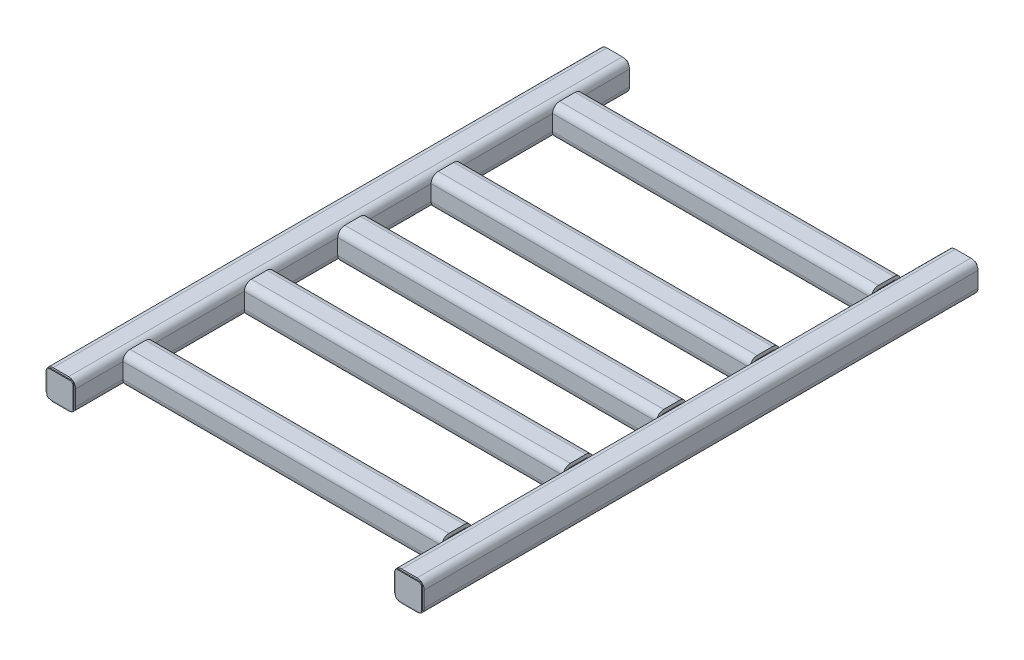
from build123d import *

# Parameters (mm, degrees)
TUBE_SQUARE_TS32X32X4_1_DEPTH   = 593
TUBE_SQUARE_TS32X32X4_1_2_DEPTH = 593
TUBE_SQUARE_TS32X32X4_1_3_DEPTH = 375.2
TUBE_SQUARE_TS32X32X4_1_4_DEPTH = 375.2
TUBE_SQUARE_TS32X32X4_1_5_DEPTH = 375.2
TUBE_SQUARE_TS32X32X4_1_6_DEPTH = 375.2
TUBE_SQUARE_TS32X32X4_1_7_DEPTH = 375.2
END_CAP1_WIDTH                  = 27.99
END_CAP1_HEIGHT                 = 27.99
END_CAP1_THICKNESS              = 1
END_CAP1_2_R                    = 3
END_CAP1_4_WIDTH                = 27.99
END_CAP1_4_HEIGHT               = 27.99
END_CAP1_4_THICKNESS            = 1
END_CAP1_5_R                    = 3
END_CAP1_7_WIDTH                = 27.99
END_CAP1_7_HEIGHT               = 27.99
END_CAP1_7_THICKNESS            = 1
END_CAP1_8_R                    = 3
END_CAP1_10_WIDTH               = 27.99
END_CAP1_10_HEIGHT              = 27.99
END_CAP1_10_THICKNESS           = 1
END_CAP1_11_R                   = 3


with BuildPart() as part:
    # Sketch113 → Tube square TS32X32X4(1) (new body)
    with BuildSketch(Plane(origin=(-186.6, 0, -296.5), x_dir=(1, 0, 0), z_dir=(0, 0, 1))):
        with BuildLine():
            Line((-8.28, -15.9), (8.28, -15.9))
            ThreePointArc((8.28, -15.9), (13.668153673, -13.668153673), (15.9, -8.28))
            Line((15.9, -8.28), (15.9, 8.28))
            ThreePointArc((15.9, 8.28), (13.668153673, 13.668153673), (8.28, 15.9))
            Line((8.28, 15.9), (-8.28, 15.9))
            ThreePointArc((-8.28, 15.9), (-13.668153673, 13.668153673), (-15.9, 8.28))
            Line((-15.9, 8.28), (-15.9, -8.28))
            ThreePointArc((-15.9, -8.28), (-13.668153673, -13.668153673), (-8.28, -15.9))
        make_face()
        with BuildLine():
            Line((-8.28, -12.09), (8.28, -12.09))
            ThreePointArc((8.28, -12.09), (10.974076836, -10.974076836), (12.09, -8.28))
            Line((12.09, -8.28), (12.09, 8.28))
            ThreePointArc((12.09, 8.28), (10.974076836, 10.974076836), (8.28, 12.09))
            Line((8.28, 12.09), (-8.28, 12.09))
            ThreePointArc((-8.28, 12.09), (-10.974076836, 10.974076836), (-12.09, 8.28))
            Line((-12.09, 8.28), (-12.09, -8.28))
            ThreePointArc((-12.09, -8.28), (-10.974076836, -10.974076836), (-8.28, -12.09))
        make_face(mode=Mode.SUBTRACT)
    extrude(amount=TUBE_SQUARE_TS32X32X4_1_DEPTH)


with BuildPart() as body_2:
    # Sketch113 on segment 2 (carried to segment 2) → Tube square TS32X32X4_1 2 (new body)
    with BuildSketch(Plane(origin=(186.6, 0, -296.5), x_dir=(1, 0, 0), z_dir=(0, 0, 1))):
        with BuildLine():
            Line((-8.28, -15.9), (8.28, -15.9))
            ThreePointArc((8.28, -15.9), (13.668153673, -13.668153673), (15.9, -8.28))
            Line((15.9, -8.28), (15.9, 8.28))
            ThreePointArc((15.9, 8.28), (13.668153673, 13.668153673), (8.28, 15.9))
            Line((8.28, 15.9), (-8.28, 15.9))
            ThreePointArc((-8.28, 15.9), (-13.668153673, 13.668153673), (-15.9, 8.28))
            Line((-15.9, 8.28), (-15.9, -8.28))
            ThreePointArc((-15.9, -8.28), (-13.668153673, -13.668153673), (-8.28, -15.9))
        make_face()
        with BuildLine():
            Line((-8.28, -12.09), (8.28, -12.09))
            ThreePointArc((8.28, -12.09), (10.974076836, -10.974076836), (12.09, -8.28))
            Line((12.09, -8.28), (12.09, 8.28))
            ThreePointArc((12.09, 8.28), (10.974076836, 10.974076836), (8.28, 12.09))
            Line((8.28, 12.09), (-8.28, 12.09))
            ThreePointArc((-8.28, 12.09), (-10.974076836, 10.974076836), (-12.09, 8.28))
            Line((-12.09, 8.28), (-12.09, -8.28))
            ThreePointArc((-12.09, -8.28), (-10.974076836, -10.974076836), (-8.28, -12.09))
        make_face(mode=Mode.SUBTRACT)
    extrude(amount=TUBE_SQUARE_TS32X32X4_1_2_DEPTH)


with BuildPart() as body_3:
    # Sketch113 on segment 3 (carried to segment 3) → Tube square TS32X32X4_1 3 (new body)
    with BuildSketch(Plane(origin=(-187.6, 0, 230), x_dir=(0, 0, -1), z_dir=(1, 0, 0))):
        with BuildLine():
            Line((-8.28, -15.9), (8.28, -15.9))
            ThreePointArc((8.28, -15.9), (13.668153673, -13.668153673), (15.9, -8.28))
            Line((15.9, -8.28), (15.9, 8.28))
            ThreePointArc((15.9, 8.28), (13.668153673, 13.668153673), (8.28, 15.9))
            Line((8.28, 15.9), (-8.28, 15.9))
            ThreePointArc((-8.28, 15.9), (-13.668153673, 13.668153673), (-15.9, 8.28))
            Line((-15.9, 8.28), (-15.9, -8.28))
            ThreePointArc((-15.9, -8.28), (-13.668153673, -13.668153673), (-8.28, -15.9))
        make_face()
        with BuildLine():
            Line((-8.28, -12.09), (8.28, -12.09))
            ThreePointArc((8.28, -12.09), (10.974076836, -10.974076836), (12.09, -8.28))
            Line((12.09, -8.28), (12.09, 8.28))
            ThreePointArc((12.09, 8.28), (10.974076836, 10.974076836), (8.28, 12.09))
            Line((8.28, 12.09), (-8.28, 12.09))
            ThreePointArc((-8.28, 12.09), (-10.974076836, 10.974076836), (-12.09, 8.28))
            Line((-12.09, 8.28), (-12.09, -8.28))
            ThreePointArc((-12.09, -8.28), (-10.974076836, -10.974076836), (-8.28, -12.09))
        make_face(mode=Mode.SUBTRACT)
    extrude(amount=TUBE_SQUARE_TS32X32X4_1_3_DEPTH)

    # Tube square TS32X32X4_1 3 end butt 1
    split(bisect_by=Plane(origin=(-170.7, 0, 230), x_dir=(0, 1, 0), z_dir=(1, 0, 0)), keep=Keep.TOP)

    # Tube square TS32X32X4_1 3 end butt 2
    split(bisect_by=Plane(origin=(170.7, 0, 230), x_dir=(0, -1, 0), z_dir=(-1, 0, 0)), keep=Keep.TOP)


with BuildPart() as body_4:
    # Sketch113 on segment 4 (carried to segment 4) → Tube square TS32X32X4_1 4 (new body)
    with BuildSketch(Plane(origin=(-187.6, 0, -230), x_dir=(0, 0, -1), z_dir=(1, 0, 0))):
        with BuildLine():
            Line((-8.28, -15.9), (8.28, -15.9))
            ThreePointArc((8.28, -15.9), (13.668153673, -13.668153673), (15.9, -8.28))
            Line((15.9, -8.28), (15.9, 8.28))
            ThreePointArc((15.9, 8.28), (13.668153673, 13.668153673), (8.28, 15.9))
            Line((8.28, 15.9), (-8.28, 15.9))
            ThreePointArc((-8.28, 15.9), (-13.668153673, 13.668153673), (-15.9, 8.28))
            Line((-15.9, 8.28), (-15.9, -8.28))
            ThreePointArc((-15.9, -8.28), (-13.668153673, -13.668153673), (-8.28, -15.9))
        make_face()
        with BuildLine():
            Line((-8.28, -12.09), (8.28, -12.09))
            ThreePointArc((8.28, -12.09), (10.974076836, -10.974076836), (12.09, -8.28))
            Line((12.09, -8.28), (12.09, 8.28))
            ThreePointArc((12.09, 8.28), (10.974076836, 10.974076836), (8.28, 12.09))
            Line((8.28, 12.09), (-8.28, 12.09))
            ThreePointArc((-8.28, 12.09), (-10.974076836, 10.974076836), (-12.09, 8.28))
            Line((-12.09, 8.28), (-12.09, -8.28))
            ThreePointArc((-12.09, -8.28), (-10.974076836, -10.974076836), (-8.28, -12.09))
        make_face(mode=Mode.SUBTRACT)
    extrude(amount=TUBE_SQUARE_TS32X32X4_1_4_DEPTH)

    # Tube square TS32X32X4_1 4 end butt 1
    split(bisect_by=Plane(origin=(-170.7, 0, -230), x_dir=(0, 1, 0), z_dir=(1, 0, 0)), keep=Keep.TOP)

    # Tube square TS32X32X4_1 4 end butt 2
    split(bisect_by=Plane(origin=(170.7, 0, -230), x_dir=(0, -1, 0), z_dir=(-1, 0, 0)), keep=Keep.TOP)


with BuildPart() as body_5:
    # Sketch113 on segment 5 (carried to segment 5) → Tube square TS32X32X4_1 5 (new body)
    with BuildSketch(Plane(origin=(187.6, 0, 100), x_dir=(0, 0, 1), z_dir=(-1, 0, 0))):
        with BuildLine():
            Line((-8.28, -15.9), (8.28, -15.9))
            ThreePointArc((8.28, -15.9), (13.668153673, -13.668153673), (15.9, -8.28))
            Line((15.9, -8.28), (15.9, 8.28))
            ThreePointArc((15.9, 8.28), (13.668153673, 13.668153673), (8.28, 15.9))
            Line((8.28, 15.9), (-8.28, 15.9))
            ThreePointArc((-8.28, 15.9), (-13.668153673, 13.668153673), (-15.9, 8.28))
            Line((-15.9, 8.28), (-15.9, -8.28))
            ThreePointArc((-15.9, -8.28), (-13.668153673, -13.668153673), (-8.28, -15.9))
        make_face()
        with BuildLine():
            Line((-8.28, -12.09), (8.28, -12.09))
            ThreePointArc((8.28, -12.09), (10.974076836, -10.974076836), (12.09, -8.28))
            Line((12.09, -8.28), (12.09, 8.28))
            ThreePointArc((12.09, 8.28), (10.974076836, 10.974076836), (8.28, 12.09))
            Line((8.28, 12.09), (-8.28, 12.09))
            ThreePointArc((-8.28, 12.09), (-10.974076836, 10.974076836), (-12.09, 8.28))
            Line((-12.09, 8.28), (-12.09, -8.28))
            ThreePointArc((-12.09, -8.28), (-10.974076836, -10.974076836), (-8.28, -12.09))
        make_face(mode=Mode.SUBTRACT)
    extrude(amount=TUBE_SQUARE_TS32X32X4_1_5_DEPTH)

    # Tube square TS32X32X4_1 5 end butt 1
    split(bisect_by=Plane(origin=(170.7, 0, 100), x_dir=(0, -1, 0), z_dir=(-1, 0, 0)), keep=Keep.TOP)

    # Tube square TS32X32X4_1 5 end butt 2
    split(bisect_by=Plane(origin=(-170.7, 0, 100), x_dir=(0, 1, 0), z_dir=(1, 0, 0)), keep=Keep.TOP)


with BuildPart() as body_6:
    # Sketch113 on segment 6 (carried to segment 6) → Tube square TS32X32X4_1 6 (new body)
    with BuildSketch(Plane(origin=(-187.6, 0, -100), x_dir=(0, 0, -1), z_dir=(1, 0, 0))):
        with BuildLine():
            Line((-8.28, -15.9), (8.28, -15.9))
            ThreePointArc((8.28, -15.9), (13.668153673, -13.668153673), (15.9, -8.28))
            Line((15.9, -8.28), (15.9, 8.28))
            ThreePointArc((15.9, 8.28), (13.668153673, 13.668153673), (8.28, 15.9))
            Line((8.28, 15.9), (-8.28, 15.9))
            ThreePointArc((-8.28, 15.9), (-13.668153673, 13.668153673), (-15.9, 8.28))
            Line((-15.9, 8.28), (-15.9, -8.28))
            ThreePointArc((-15.9, -8.28), (-13.668153673, -13.668153673), (-8.28, -15.9))
        make_face()
        with BuildLine():
            Line((-8.28, -12.09), (8.28, -12.09))
            ThreePointArc((8.28, -12.09), (10.974076836, -10.974076836), (12.09, -8.28))
            Line((12.09, -8.28), (12.09, 8.28))
            ThreePointArc((12.09, 8.28), (10.974076836, 10.974076836), (8.28, 12.09))
            Line((8.28, 12.09), (-8.28, 12.09))
            ThreePointArc((-8.28, 12.09), (-10.974076836, 10.974076836), (-12.09, 8.28))
            Line((-12.09, 8.28), (-12.09, -8.28))
            ThreePointArc((-12.09, -8.28), (-10.974076836, -10.974076836), (-8.28, -12.09))
        make_face(mode=Mode.SUBTRACT)
    extrude(amount=TUBE_SQUARE_TS32X32X4_1_6_DEPTH)

    # Tube square TS32X32X4_1 6 end butt 1
    split(bisect_by=Plane(origin=(-170.7, 0, -100), x_dir=(0, 1, 0), z_dir=(1, 0, 0)), keep=Keep.TOP)

    # Tube square TS32X32X4_1 6 end butt 2
    split(bisect_by=Plane(origin=(170.7, 0, -100), x_dir=(0, -1, 0), z_dir=(-1, 0, 0)), keep=Keep.TOP)


with BuildPart() as body_7:
    # Sketch113 on segment 7 (carried to segment 7) → Tube square TS32X32X4_1 7 (new body)
    with BuildSketch(Plane.ZY.offset(-187.6)):
        with BuildLine():
            Line((-8.28, -15.9), (8.28, -15.9))
            ThreePointArc((8.28, -15.9), (13.668153673, -13.668153673), (15.9, -8.28))
            Line((15.9, -8.28), (15.9, 8.28))
            ThreePointArc((15.9, 8.28), (13.668153673, 13.668153673), (8.28, 15.9))
            Line((8.28, 15.9), (-8.28, 15.9))
            ThreePointArc((-8.28, 15.9), (-13.668153673, 13.668153673), (-15.9, 8.28))
            Line((-15.9, 8.28), (-15.9, -8.28))
            ThreePointArc((-15.9, -8.28), (-13.668153673, -13.668153673), (-8.28, -15.9))
        make_face()
        with BuildLine():
            Line((-8.28, -12.09), (8.28, -12.09))
            ThreePointArc((8.28, -12.09), (10.974076836, -10.974076836), (12.09, -8.28))
            Line((12.09, -8.28), (12.09, 8.28))
            ThreePointArc((12.09, 8.28), (10.974076836, 10.974076836), (8.28, 12.09))
            Line((8.28, 12.09), (-8.28, 12.09))
            ThreePointArc((-8.28, 12.09), (-10.974076836, 10.974076836), (-12.09, 8.28))
            Line((-12.09, 8.28), (-12.09, -8.28))
            ThreePointArc((-12.09, -8.28), (-10.974076836, -10.974076836), (-8.28, -12.09))
        make_face(mode=Mode.SUBTRACT)
    extrude(amount=TUBE_SQUARE_TS32X32X4_1_7_DEPTH)

    # Tube square TS32X32X4_1 7 end butt 1
    split(bisect_by=Plane(origin=(170.7, 0, 0), x_dir=(0, -1, 0), z_dir=(-1, 0, 0)), keep=Keep.TOP)

    # Tube square TS32X32X4_1 7 end butt 2
    split(bisect_by=Plane.YZ.offset(-170.7), keep=Keep.TOP)


with BuildPart() as body_8:
    # End cap1: an end cap: a rectangular plate 1.0 thick over the member's open end
    with BuildSketch(Plane(origin=(186.6, 0, 296.5), x_dir=(1, 0, 0), z_dir=(0, 0, 1))):
        Rectangle(END_CAP1_WIDTH, END_CAP1_HEIGHT)
    extrude(amount=END_CAP1_THICKNESS)

    # End cap1 2
    end_cap1_2_edges = [body_8.edges().sort_by_distance(p)[0] for p in [
        (172.605, -13.995, 297),
        (172.605, 13.995, 297),
        (200.595, -13.995, 297),
        (200.595, 13.995, 297),
    ]]
    fillet(end_cap1_2_edges, radius=END_CAP1_2_R)


with BuildPart() as body_9:
    # End cap1 4: an end cap: a rectangular plate 1.0 thick over the member's open end
    with BuildSketch(Plane(origin=(-186.6, 0, 296.5), x_dir=(1, 0, 0), z_dir=(0, 0, 1))):
        Rectangle(END_CAP1_4_WIDTH, END_CAP1_4_HEIGHT)
    extrude(amount=END_CAP1_4_THICKNESS)

    # End cap1 5
    end_cap1_5_edges = [body_9.edges().sort_by_distance(p)[0] for p in [
        (-200.595, -13.995, 297),
        (-200.595, 13.995, 297),
        (-172.605, -13.995, 297),
        (-172.605, 13.995, 297),
    ]]
    fillet(end_cap1_5_edges, radius=END_CAP1_5_R)


with BuildPart() as body_10:
    # End cap1 7: an end cap: a rectangular plate 1.0 thick over the member's open end
    with BuildSketch(Plane(origin=(-186.6, 0, -296.5), x_dir=(1, 0, 0), z_dir=(0, 0, -1))):
        Rectangle(END_CAP1_7_WIDTH, END_CAP1_7_HEIGHT)
    extrude(amount=END_CAP1_7_THICKNESS)

    # End cap1 8
    end_cap1_8_edges = [body_10.edges().sort_by_distance(p)[0] for p in [
        (-200.595, 13.995, -297),
        (-200.595, -13.995, -297),
        (-172.605, 13.995, -297),
        (-172.605, -13.995, -297),
    ]]
    fillet(end_cap1_8_edges, radius=END_CAP1_8_R)


with BuildPart() as body_11:
    # End cap1 10: an end cap: a rectangular plate 1.0 thick over the member's open end
    with BuildSketch(Plane(origin=(186.6, 0, -296.5), x_dir=(1, 0, 0), z_dir=(0, 0, -1))):
        Rectangle(END_CAP1_10_WIDTH, END_CAP1_10_HEIGHT)
    extrude(amount=END_CAP1_10_THICKNESS)

    # End cap1 11
    end_cap1_11_edges = [body_11.edges().sort_by_distance(p)[0] for p in [
        (172.605, 13.995, -297),
        (172.605, -13.995, -297),
        (200.595, 13.995, -297),
        (200.595, -13.995, -297),
    ]]
    fillet(end_cap1_11_edges, radius=END_CAP1_11_R)


solid = Compound([part.part, body_2.part, body_3.part, body_4.part, body_5.part, body_6.part, body_7.part, body_8.part, body_9.part, body_10.part, body_11.part])
